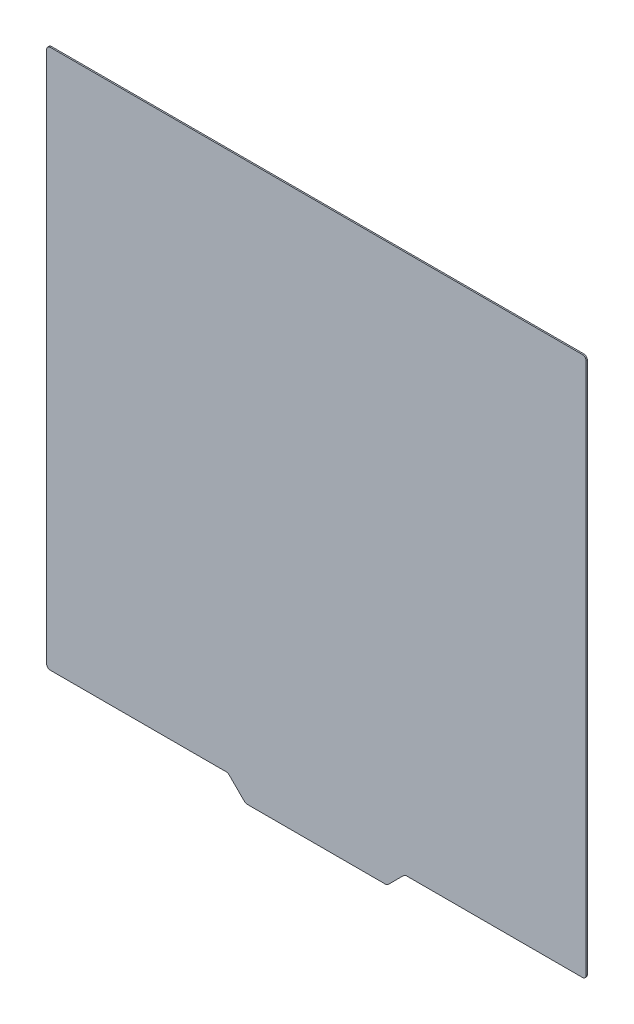
from build123d import *

# Parameters (mm, degrees)
BOSS_EXTRUDE1_DEPTH = 0.75
FILLET1_R           = 2


with BuildPart() as part:
    # Sketch1 → Boss-Extrude1 (new body)
    with BuildSketch(Plane.XY):
        Polygon((-152.5, -152.5), (-50, -152.5), (-40, -162.5), (40, -162.5), (50, -152.5), (152.5, -152.5), (152.5, 152.5), (-152.5, 152.5), align=None)
    extrude(amount=BOSS_EXTRUDE1_DEPTH)

    # Fillet1
    fillet1_edges = [part.edges().sort_by_distance(p)[0] for p in [
        (152.5, -152.5, 0.375),
        (50, -152.5, 0.375),
        (40, -162.5, 0.375),
        (-40, -162.5, 0.375),
        (-50, -152.5, 0.375),
        (-152.5, -152.5, 0.375),
        (-152.5, 152.5, 0.375),
        (152.5, 152.5, 0.375),
    ]]
    fillet(fillet1_edges, radius=FILLET1_R)


solid = part.part
